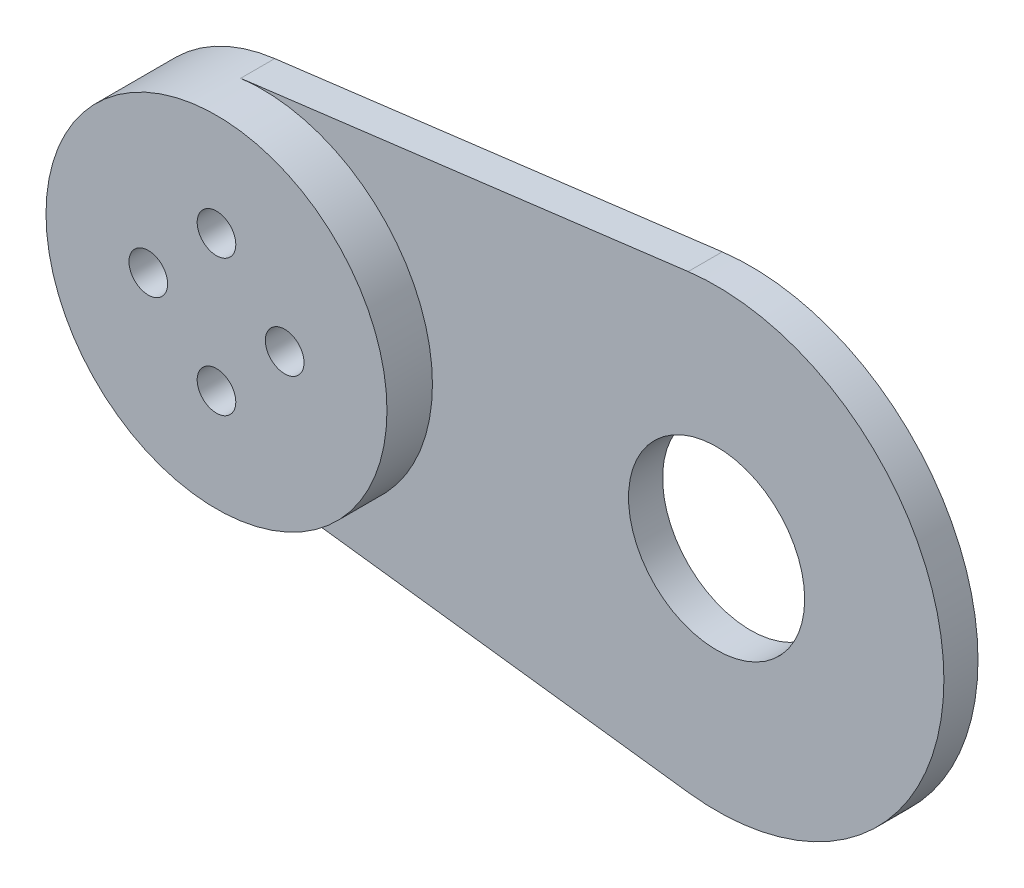
from build123d import *

# Parameters (mm, degrees)
SKETCH1_R               = 7.75
BOSS_EXTRUDE1_DEPTH     = 3
BOSS_EXTRUDE2_START     = 4
SKETCH2_R               = 15
BOSS_EXTRUDE2_DEPTH     = 4
CUT_EXTRUDE1_DEPTH      = 104.81508538
CUT_EXTRUDE1_DEPTH_BACK = 104.81508538
SKETCH2_3_R             = 1.7


with BuildPart() as part:
    # Sketch1 → Boss-Extrude1 (new body)
    with BuildSketch(Plane.XY.offset(3)):
        with BuildLine():
            Line((-42.810452402, 40.800302889), (-82.185452402, 35.839519181))
            ThreePointArc((-82.185452402, 35.839519181), (-95.310452402, 20.957168056), (-82.185452402, 6.074816932))
            Line((-82.185452402, 6.074816932), (-42.810452402, 1.114033223))
            ThreePointArc((-42.810452402, 1.114033223), (-20.310452402, 20.957168056), (-42.810452402, 40.800302889))
        make_face()
        with Locations((-40.310452402, 20.957168056)):
            Circle(SKETCH1_R, mode=Mode.SUBTRACT)
    extrude(amount=-BOSS_EXTRUDE1_DEPTH)

    # Sketch2 → Boss-Extrude2 (add)
    with BuildSketch(Plane.XY.offset(3).offset(BOSS_EXTRUDE2_START)):
        with Locations((-80.310452402, 20.957168056)):
            Circle(SKETCH2_R)
    extrude(amount=-BOSS_EXTRUDE2_DEPTH)

    # Sketch2<3> → Cut-Extrude1 (cut, two sides: drawn at the far end of the back side and taken through both)
    with BuildSketch(Plane.XY.offset(3).offset(-CUT_EXTRUDE1_DEPTH_BACK)):
        with Locations((-86.310452402, 20.957168056)):
            Circle(SKETCH2_3_R)
        with Locations((-80.310452402, 26.957168056)):
            Circle(SKETCH2_3_R)
        with Locations((-74.310452402, 20.957168056)):
            Circle(SKETCH2_3_R)
        with Locations((-80.310452402, 14.957168056)):
            Circle(SKETCH2_3_R)
    extrude(amount=CUT_EXTRUDE1_DEPTH + CUT_EXTRUDE1_DEPTH_BACK, mode=Mode.SUBTRACT)


solid = part.part
